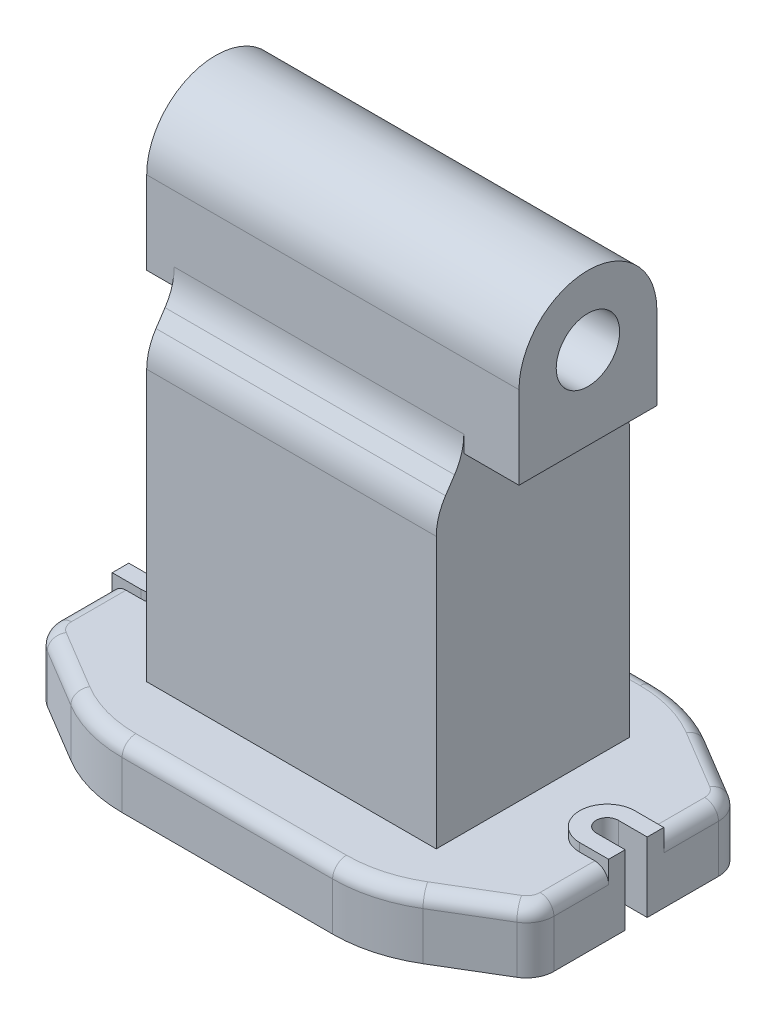
from build123d import *

# Parameters (mm, degrees)
BASE_DEPTH                    = 22.3
RESALTO_FUROS_DE_FIXA_O_DEPTH = 3
SKETCH4_W                     = 105
SKETCH4_H                     = 70
CORPO_RETANGULAR_DEPTH        = 104.2
CORPO_INCLINADO_DEPTH         = 105
SKETCH5_4_R                   = 11.5
CORPO_ARREDONDADO_BACK_DEPTH  = 10
SKETCH5_5_R                   = 11.5
CORPO_ARREDONDADO_FRONT_DEPTH = 125
SKETCH9_R                     = 4
PINOS_GUIA_DEPTH              = 20
RAIOS_50MM_R                  = 50
RAIOS_20MM_R                  = 20
RAIOS_10MM_R                  = 10
RAIOS_5MM_R                   = 5
FURO_M10X50_D                 = 9
FURO_M10X50_DEPTH             = 47.296127214
FURO_M10X50_TIP               = 2.703872786


with BuildPart() as part:
    # Sketch1 → Base (new body)
    with BuildSketch(Plane(origin=(0, 0, 0), x_dir=(1, 0, 0), z_dir=(0, 1, 0))):
        with BuildLine():
            Line((-27.5, 54.25), (-38, 54.25))
            Line((-38, 54.25), (-38, 22.75))
            Line((-38, 22.75), (0, 0))
            Line((0, 0), (104, 0))
            Line((104, 0), (142, 22.75))
            Line((142, 22.75), (142, 54.25))
            Line((142, 54.25), (131.5, 54.25))
            ThreePointArc((131.5, 54.25), (127.5, 58.25), (131.5, 62.25))
            Line((131.5, 62.25), (142, 62.25))
            Line((142, 62.25), (142, 93.75))
            Line((142, 93.75), (104, 116.5))
            Line((104, 116.5), (0, 116.5))
            Line((0, 116.5), (-38, 93.75))
            Line((-38, 93.75), (-38, 62.25))
            Line((-38, 62.25), (-27.5, 62.25))
            ThreePointArc((-27.5, 62.25), (-23.5, 58.25), (-27.5, 54.25))
        make_face()
    extrude(amount=BASE_DEPTH)

    # Sketch3 → Resalto - Furos de Fixação (add)
    with BuildSketch(Plane(origin=(0, 22.3, 0), x_dir=(1, 0, 0), z_dir=(0, 1, 0))):
        with BuildLine():
            Line((-27.5, 54.25), (-38, 54.25))
            Line((-38, 54.25), (-38, 48.25))
            Line((-38, 48.25), (-27.5, 48.25))
            ThreePointArc((-27.5, 48.25), (-17.5, 58.25), (-27.5, 68.25))
            Line((-27.5, 68.25), (-38, 68.25))
            Line((-38, 68.25), (-38, 62.25))
            Line((-38, 62.25), (-27.5, 62.25))
            ThreePointArc((-27.5, 62.25), (-23.5, 58.25), (-27.5, 54.25))
        make_face()
        with BuildLine():
            Line((142, 54.25), (142, 48.25))
            Line((142, 48.25), (131.5, 48.25))
            ThreePointArc((131.5, 48.25), (121.5, 58.25), (131.5, 68.25))
            Line((131.5, 68.25), (142, 68.25))
            Line((142, 68.25), (142, 62.25))
            Line((142, 62.25), (131.5, 62.25))
            ThreePointArc((131.5, 62.25), (127.5, 58.25), (131.5, 54.25))
            Line((131.5, 54.25), (142, 54.25))
        make_face()
    extrude(amount=RESALTO_FUROS_DE_FIXA_O_DEPTH)

    # Sketch4 → Corpo Retangular (add)
    with BuildSketch(Plane(origin=(0, 22.3, 0), x_dir=(1, 0, 0), z_dir=(0, 1, 0))):
        with Locations((52, 58.25)):
            Rectangle(SKETCH4_W, SKETCH4_H)
    extrude(amount=CORPO_RETANGULAR_DEPTH)

    # Sketch5 → Corpo Inclinado (add)
    with BuildSketch(Plane.ZY.offset(0.5)):
        Polygon((-33.25, 141.5), (-83.25, 141.5), (-93.25, 126.5), (-23.25, 126.5), align=None)
    extrude(amount=-CORPO_INCLINADO_DEPTH)



with BuildPart() as body_2:
    # Sketch5<4> → Corpo Arredondado - Back (new body)
    with BuildSketch(Plane.ZY.offset(0.5)):
        with BuildLine():
            Line((-33.25, 141.5), (-33.25, 171.5))
            ThreePointArc((-33.25, 171.5), (-58.25, 196.5), (-83.25, 171.5))
            Line((-83.25, 171.5), (-83.25, 141.5))
            Line((-83.25, 141.5), (-33.25, 141.5))
        make_face()
        with Locations((-58.25, 171.5)):
            Circle(SKETCH5_4_R, mode=Mode.SUBTRACT)
    extrude(amount=CORPO_ARREDONDADO_BACK_DEPTH)


with BuildPart() as part_1:
    add(part.part)

    add(body_2.part)  # Corpo Arredondado - Front merges body 2
    # Sketch5<5> → Corpo Arredondado - Front (add)
    with BuildSketch(Plane.ZY.offset(0.5)):
        with BuildLine():
            Line((-33.25, 141.5), (-33.25, 171.5))
            ThreePointArc((-33.25, 171.5), (-58.25, 196.5), (-83.25, 171.5))
            Line((-83.25, 171.5), (-83.25, 141.5))
            Line((-83.25, 141.5), (-33.25, 141.5))
        make_face()
        with Locations((-58.25, 171.5)):
            Circle(SKETCH5_5_R, mode=Mode.SUBTRACT)
    extrude(amount=-CORPO_ARREDONDADO_FRONT_DEPTH)

    # Sketch9 → Pinos Guia (add)
    with BuildSketch(Plane.XZ):
        with Locations((2.5, -58.25)):
            Circle(SKETCH9_R)
        with Locations((101.5, -58.25)):
            Circle(SKETCH9_R)
    extrude(amount=PINOS_GUIA_DEPTH)

    # Raios 50mm
    raios_50mm_edges = [part_1.edges().sort_by_distance(p)[0] for p in [
        (0, 11.15, -116.5),
        (104, 11.15, -116.5),
        (0, 11.15, 0),
        (104, 11.15, 0),
    ]]
    fillet(raios_50mm_edges, radius=RAIOS_50MM_R)

    # Raios 20mm
    raios_20mm_edges = [part_1.edges().sort_by_distance(p)[0] for p in [
        (52, 126.5, -93.25),
        (52, 141.5, -83.25),
        (52, 141.5, -33.25),
        (52, 126.5, -23.25),
    ]]
    fillet(raios_20mm_edges, radius=RAIOS_20MM_R)

    # Raios 10mm
    raios_10mm_edges = [part_1.edges().sort_by_distance(p)[0] for p in [
        (-38, 11.15, -93.75),
        (-38, 11.15, -22.75),
        (142, 11.15, -93.75),
        (142, 11.15, -22.75),
    ]]
    fillet(raios_10mm_edges, radius=RAIOS_10MM_R)

    # Raios 5mm
    raios_5mm_edges = [part_1.edges().sort_by_distance(p)[0] for p in [
        (142, 22.3, -78.165851268),
        (140.699613253, 22.3, -93.01290211),
        (126.498390623, 22.3, -103.030568772),
        (103.500210672, 22.3, -114.692200918),
        (-38, 22.3, -78.165851268),
        (-36.699613253, 22.3, -93.01290211),
        (-22.498390623, 22.3, -103.030568772),
        (0.499789328, 22.3, -114.692200918),
        (-38, 22.3, -38.334148732),
        (-36.699613253, 22.3, -23.48709789),
        (-22.498390623, 22.3, -13.469431228),
        (0.499789328, 22.3, -1.807799082),
        (142, 22.3, -38.334148732),
        (140.699613253, 22.3, -23.48709789),
        (126.498390623, 22.3, -13.469431228),
        (103.500210672, 22.3, -1.807799082),
        (52, 22.3, -116.5),
        (52, 22.3, 0),
    ]]
    fillet(raios_5mm_edges, radius=RAIOS_5MM_R)

    # Furo M10x50
    with Locations(Plane.ZY.offset(0.5)):
        with Locations((-58.25, 121.5)):
            Hole(FURO_M10X50_D / 2, depth=FURO_M10X50_DEPTH)
            with Locations((0, 0, -(FURO_M10X50_DEPTH + FURO_M10X50_TIP / 2))):  # 118° drill point
                Cone(0, FURO_M10X50_D / 2, FURO_M10X50_TIP, mode=Mode.SUBTRACT)


solid = part_1.part
